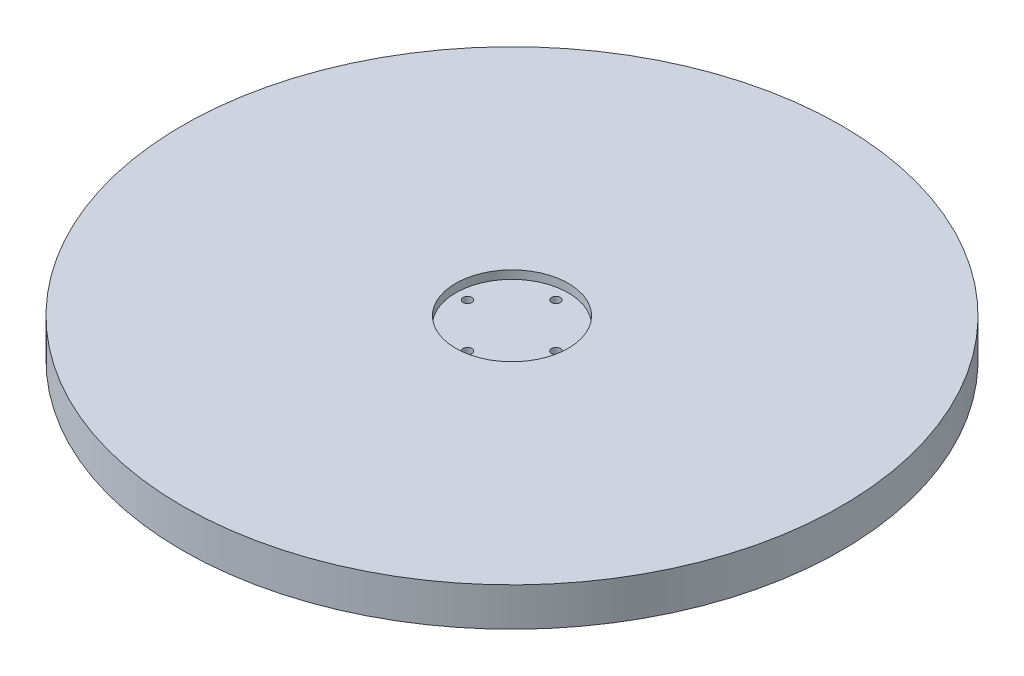
from build123d import *

# Parameters (mm, degrees)
SKETCH1_R                   = 60
BOSS_EXTRUDE1_DEPTH         = 7
SKETCH2_R                   = 10.25
CUT_EXTRUDE1_DEPTH          = 1.5
TAP_DRILL_FOR_M2X0_4_TAP1_D = 1.6
CIRPATTERN1_COUNT           = 4
SKETCH8_R                   = 35
SKETCH8_R_2                 = 25
CUT_EXTRUDE_THIN1_DEPTH     = 4


with BuildPart() as part:
    # Sketch1 → Boss-Extrude1 (new body)
    with BuildSketch(Plane(origin=(0, 0, 0), x_dir=(1, 0, 0), z_dir=(0, 1, 0))):
        with Locations(Location((0, 0, 0), (0, 0, 270))):
            Circle(SKETCH1_R)
    extrude(amount=BOSS_EXTRUDE1_DEPTH)

    # Sketch2 → Cut-Extrude1 (cut)
    with BuildSketch(Plane(origin=(0, 7, 0), x_dir=(1, 0, 0), z_dir=(0, 1, 0))):
        with Locations(Location((0, 0, 0), (0, 0, 270))):
            Circle(SKETCH2_R)
    extrude(amount=-CUT_EXTRUDE1_DEPTH, mode=Mode.SUBTRACT)

    # Tap Drill for M2x0.4 Tap1 (through all)
    with Locations(Plane(origin=(0, 5.5, 0), x_dir=(1, 0, 0), z_dir=(0, 1, 0))):
        with Locations((0, 8)):
            tap_drill_for_m2x0_4_tap1 = Hole(TAP_DRILL_FOR_M2X0_4_TAP1_D / 2)

    # CirPattern1: Tap Drill for M2x0.4 Tap1 ×4 about axis
    cirpattern1_axis = Axis((0, 0, 0.049031578), (0, 1, 0))
    for i in range(1, CIRPATTERN1_COUNT):
        add(tap_drill_for_m2x0_4_tap1.rotate(cirpattern1_axis, i * 360 / CIRPATTERN1_COUNT), mode=Mode.SUBTRACT)

    # Sketch8 → Cut-Extrude-Thin1 (cut)
    with BuildSketch(Plane.XZ):
        Circle(SKETCH8_R)
        Circle(SKETCH8_R_2, mode=Mode.SUBTRACT)
    extrude(amount=-CUT_EXTRUDE_THIN1_DEPTH, mode=Mode.SUBTRACT)


solid = part.part
